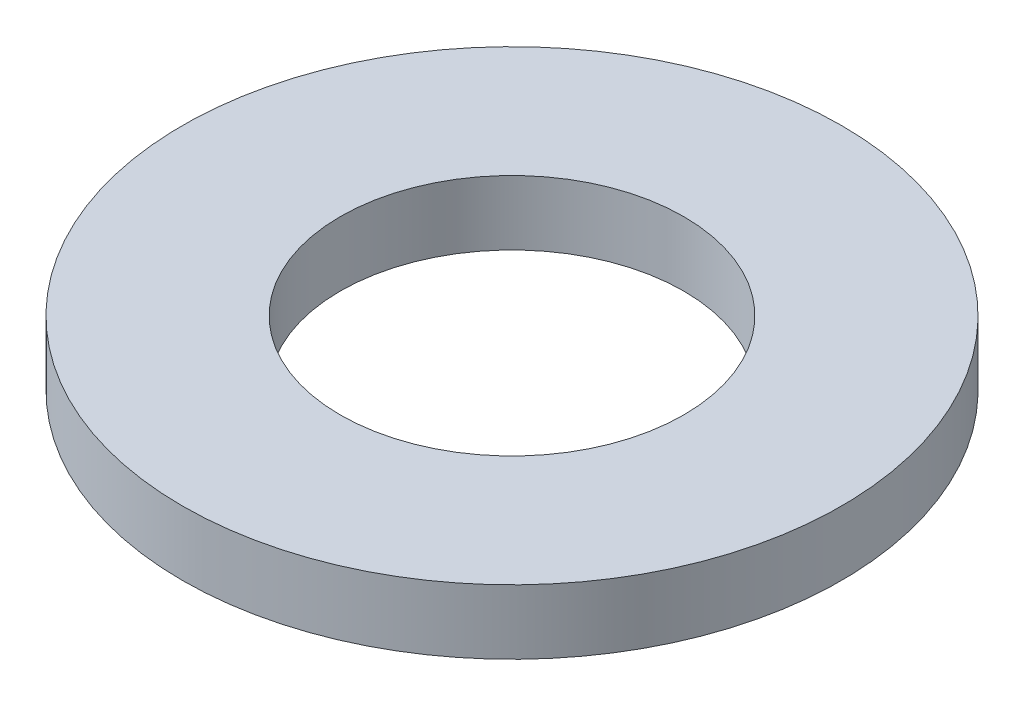
from build123d import *

# Parameters (mm, degrees)
SKETCH1_R           = 62.833006194
SKETCH1_R_2         = 32.75
BOSS_EXTRUDE1_DEPTH = 12.3


with BuildPart() as part:
    # Sketch1 → Boss-Extrude1 (new body)
    with BuildSketch(Plane(origin=(0, 0, 0), x_dir=(-1, 0, 0), z_dir=(0, 1, 0))):
        with Locations(Location((-19.458166261, -21.058476324, 0), (0, 0, 90))):
            Circle(SKETCH1_R)
        with Locations(Location((-19.458166261, -21.058476324, 0), (0, 0, 90))):
            Circle(SKETCH1_R_2, mode=Mode.SUBTRACT)
    extrude(amount=BOSS_EXTRUDE1_DEPTH)


solid = part.part
